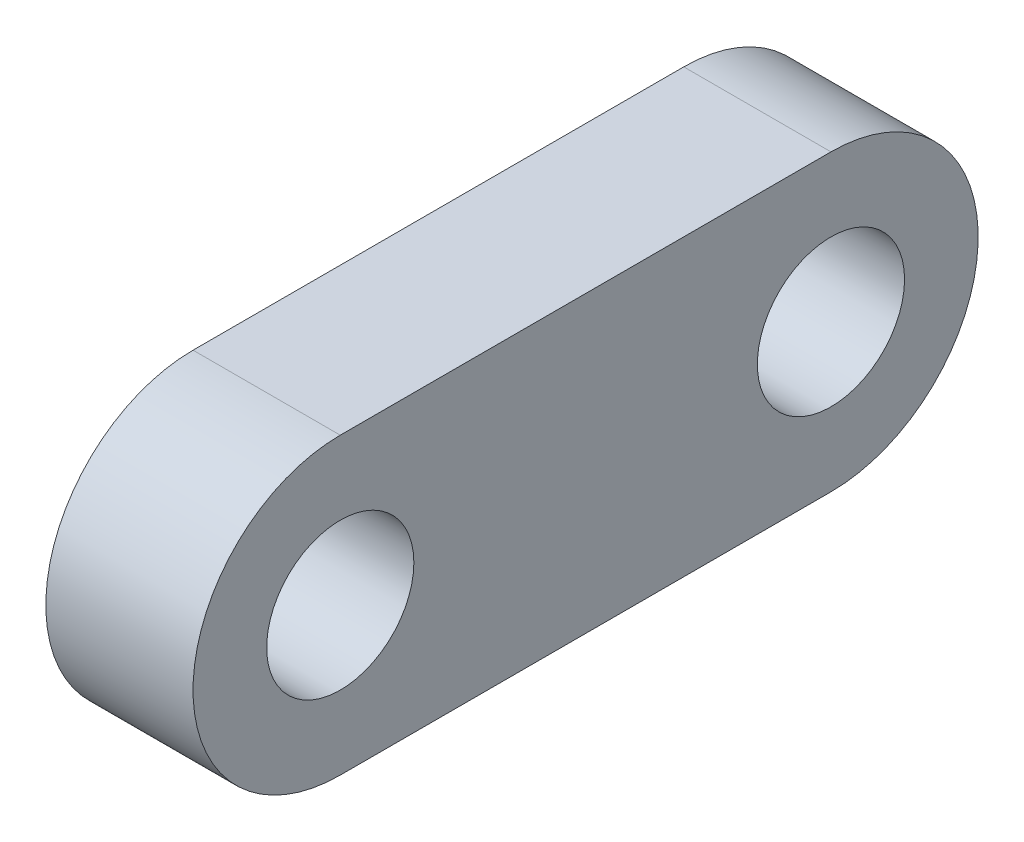
from build123d import *

# Parameters (mm, degrees)
SKETCH_1_R      = 1.5
EXTRUDE_1_DEPTH = 3


with BuildPart() as part:
    # 草图1 → 凸台-拉伸1 (new body)
    with BuildSketch(Plane(origin=(0, 0, 0), x_dir=(0, 0, -1), z_dir=(1, 0, 0))):
        with BuildLine():
            Line((0, 4.5), (10, 4.5))
            ThreePointArc((10, 4.5), (13, 1.5), (10, -1.5))
            Line((10, -1.5), (0, -1.5))
            ThreePointArc((0, -1.5), (-3, 1.5), (0, 4.5))
        make_face()
        with Locations((0, 1.5)):
            Circle(SKETCH_1_R, mode=Mode.SUBTRACT)
        with Locations((10, 1.5)):
            Circle(SKETCH_1_R, mode=Mode.SUBTRACT)
    extrude(amount=EXTRUDE_1_DEPTH)


solid = part.part
